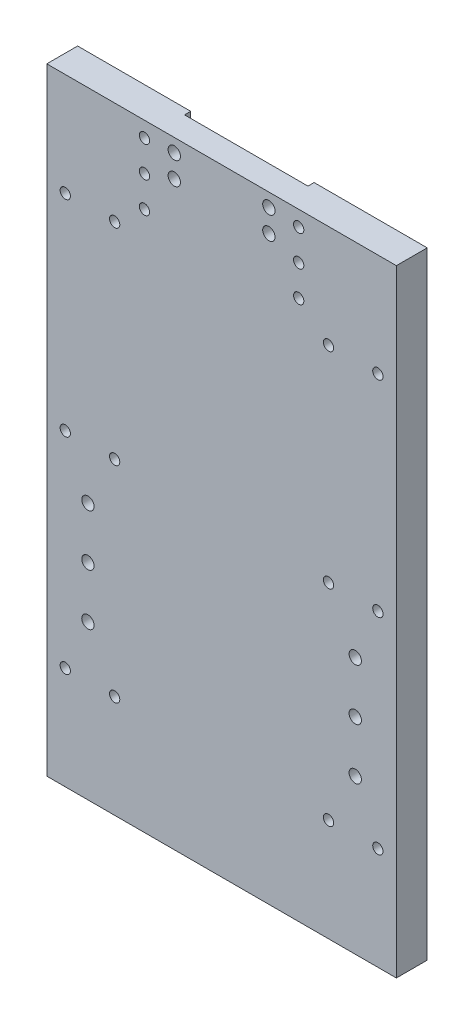
from build123d import *

# Parameters (mm, degrees)
ESQUISSE1_W             = 170
ESQUISSE1_H             = 300
BOSS_EXTRU_1_DEPTH      = 15
ESQUISSE2_R             = 2.5
ENL_V_MAT_EXTRU_1_DEPTH = 15
ESQUISSE3_W             = 60
ESQUISSE3_H             = 25
ENL_V_MAT_EXTRU_2_DEPTH = 3
ESQUISSE4_R             = 3
ENL_V_MAT_EXTRU_3_DEPTH = 12
ENL_V_START             = -15
ESQUISSE5_R             = 2.5
ENL_V_MAT_EXTRU_4_DEPTH = 15
ESQUISSE6_R             = 3
ENL_V_MAT_EXTRU_5_DEPTH = 15


with BuildPart() as part:
    # Esquisse1 → Boss.-Extru.1 (new body)
    with BuildSketch(Plane.XY):
        with Locations((85, 150)):
            Rectangle(ESQUISSE1_W, ESQUISSE1_H)
    extrude(amount=BOSS_EXTRU_1_DEPTH)

    # Esquisse2 → Enlèv. mat.-Extru.1 (cut)
    with BuildSketch(Plane.XY.offset(15)):
        with Locations((9, 250)):
            Circle(ESQUISSE2_R)
        with Locations(Location((33, 250, 0), (0, 0, 180))):
            Circle(ESQUISSE2_R)
        with Locations((9, 150)):
            Circle(ESQUISSE2_R)
        with Locations(Location((33, 150, 0), (0, 0, 180))):
            Circle(ESQUISSE2_R)
        with Locations((33, 50)):
            Circle(ESQUISSE2_R)
        with Locations(Location((9, 50, 0), (0, 0, 180))):
            Circle(ESQUISSE2_R)
        with Locations((161, 50)):
            Circle(ESQUISSE2_R)
        with Locations(Location((137, 50, 0), (0, 0, 180))):
            Circle(ESQUISSE2_R)
        with Locations((137, 150)):
            Circle(ESQUISSE2_R)
        with Locations(Location((161, 150, 0), (0, 0, 180))):
            Circle(ESQUISSE2_R)
        with Locations((137, 250)):
            Circle(ESQUISSE2_R)
        with Locations(Location((161, 250, 0), (0, 0, 180))):
            Circle(ESQUISSE2_R)
    extrude(amount=-ENL_V_MAT_EXTRU_1_DEPTH, mode=Mode.SUBTRACT)

    # Esquisse3 → Enlèv. mat.-Extru.2 (cut)
    with BuildSketch(Plane(origin=(0, 0, 0), x_dir=(-1, 0, 0), z_dir=(0, 0, -1))):
        with Locations((-85, 287.5)):
            Rectangle(ESQUISSE3_W, ESQUISSE3_H)
    extrude(amount=-ENL_V_MAT_EXTRU_2_DEPTH, mode=Mode.SUBTRACT)

    # Esquisse4 → Enlèv. mat.-Extru.3 (cut)
    with BuildSketch(Plane(origin=(0, 0, 3), x_dir=(-1, 0, 0), z_dir=(0, 0, -1))):
        with Locations((-108, 293.5)):
            Circle(ESQUISSE4_R)
        with Locations((-62, 293.5)):
            Circle(ESQUISSE4_R)
        with Locations((-108, 282.5)):
            Circle(ESQUISSE4_R)
        with Locations((-62, 282.5)):
            Circle(ESQUISSE4_R)
    extrude(amount=-ENL_V_MAT_EXTRU_3_DEPTH, mode=Mode.SUBTRACT)

    # Esquisse5 → Enlèv. mat.-Extru.4 (cut)
    with BuildSketch(Plane.XY.offset(15).offset(ENL_V_START)):
        with Locations((47.5, 292.5)):
            Circle(ESQUISSE5_R)
        with Locations((47.5, 277.5)):
            Circle(ESQUISSE5_R)
        with Locations(Location((47.5, 262.5, 0), (0, 0, 180))):
            Circle(ESQUISSE5_R)
        with Locations((122.5, 262.5)):
            Circle(ESQUISSE5_R)
        with Locations(Location((122.5, 277.5, 0), (0, 0, 180))):
            Circle(ESQUISSE5_R)
        with Locations(Location((122.5, 292.5, 0), (0, 0, 180))):
            Circle(ESQUISSE5_R)
    extrude(amount=ENL_V_MAT_EXTRU_4_DEPTH, mode=Mode.SUBTRACT)

    # Esquisse6 → Enlèv. mat.-Extru.5 (cut)
    with BuildSketch(Plane.XY.offset(15)):
        with Locations((20, 100)):
            Circle(ESQUISSE6_R)
        with Locations((20, 125)):
            Circle(ESQUISSE6_R)
        with Locations(Location((20, 75, 0), (0, 0, 180))):
            Circle(ESQUISSE6_R)
        with Locations((150, 75)):
            Circle(ESQUISSE6_R)
        with Locations(Location((150, 125, 0), (0, 0, 180))):
            Circle(ESQUISSE6_R)
        with Locations(Location((150, 100, 0), (0, 0, 180))):
            Circle(ESQUISSE6_R)
    extrude(amount=-ENL_V_MAT_EXTRU_5_DEPTH, mode=Mode.SUBTRACT)


solid = part.part
